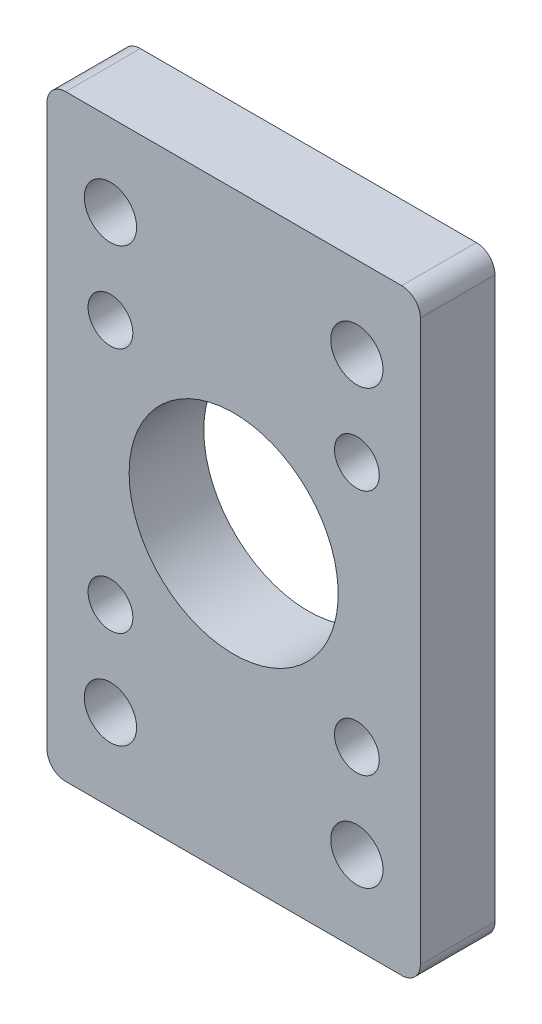
from build123d import *

# Parameters (mm, degrees)
SKETCH_2_W                 = 50
SKETCH_2_H                 = 80
EXTRUDE_1_DEPTH            = 10
SKETCH_3_R                 = 3.5
SKETCH_3_R_2               = 3
CUT_EXTRUDE_1_DEPTH        = 49.218253805
MIRROR_2_COPY_1_SKETCH_R   = 3.5
MIRROR_2_COPY_1_SKETCH_R_2 = 3
MIRROR_2_COPY_1_DEPTH      = 49.218253805
SKETCH_4_R                 = 14
CUT_EXTRUDE_2_DEPTH        = 49.218253805
FILLET_1_R                 = 2.5


with BuildPart() as part:
    # 草图2 → 凸台-拉伸1 (new body)
    with BuildSketch(Plane.XY):
        Rectangle(SKETCH_2_W, SKETCH_2_H)
    extrude(amount=EXTRUDE_1_DEPTH)

    # 草图3 → 切除-拉伸1 (cut, through all)
    with BuildSketch(Plane(origin=(0, 0, 0), x_dir=(-1, 0, 0), z_dir=(0, 0, -1))):
        with Locations((16.5, 29)):
            Circle(SKETCH_3_R)
        with Locations((16.5, 16.5)):
            Circle(SKETCH_3_R_2)
    cut_extrude_1 = extrude(amount=-CUT_EXTRUDE_1_DEPTH, mode=Mode.SUBTRACT)

    # 镜向1: 切除-拉伸1 across plane
    add(cut_extrude_1.mirror(Plane(origin=(0, 0, 0), x_dir=(0, 0, 1), z_dir=(1, 0, 0))), mode=Mode.SUBTRACT)

    # 镜向2: 切除-拉伸1 across plane
    add(cut_extrude_1.mirror(Plane.ZX), mode=Mode.SUBTRACT)

    # 镜向2 copy 1 sketch → 镜向2 copy 1 (cut, through all)
    with BuildSketch(Plane(origin=(0, 0, 0), x_dir=(1, 0, 0), z_dir=(0, 0, -1))):
        with Locations((16.5, 29)):
            Circle(MIRROR_2_COPY_1_SKETCH_R)
        with Locations((16.5, 16.5)):
            Circle(MIRROR_2_COPY_1_SKETCH_R_2)
    extrude(amount=-MIRROR_2_COPY_1_DEPTH, mode=Mode.SUBTRACT)

    # 草图4 → 切除-拉伸2 (cut, through all)
    with BuildSketch(Plane(origin=(0, 0, 0), x_dir=(-1, 0, 0), z_dir=(0, 0, -1))):
        Circle(SKETCH_4_R)
    extrude(amount=-CUT_EXTRUDE_2_DEPTH, mode=Mode.SUBTRACT)

    # 圆角1
    fillet_1_edges = [part.edges().sort_by_distance(p)[0] for p in [
        (-25, 40, 5),
        (25, 40, 5),
        (25, -40, 5),
        (-25, -40, 5),
    ]]
    fillet(fillet_1_edges, radius=FILLET_1_R)


solid = part.part
